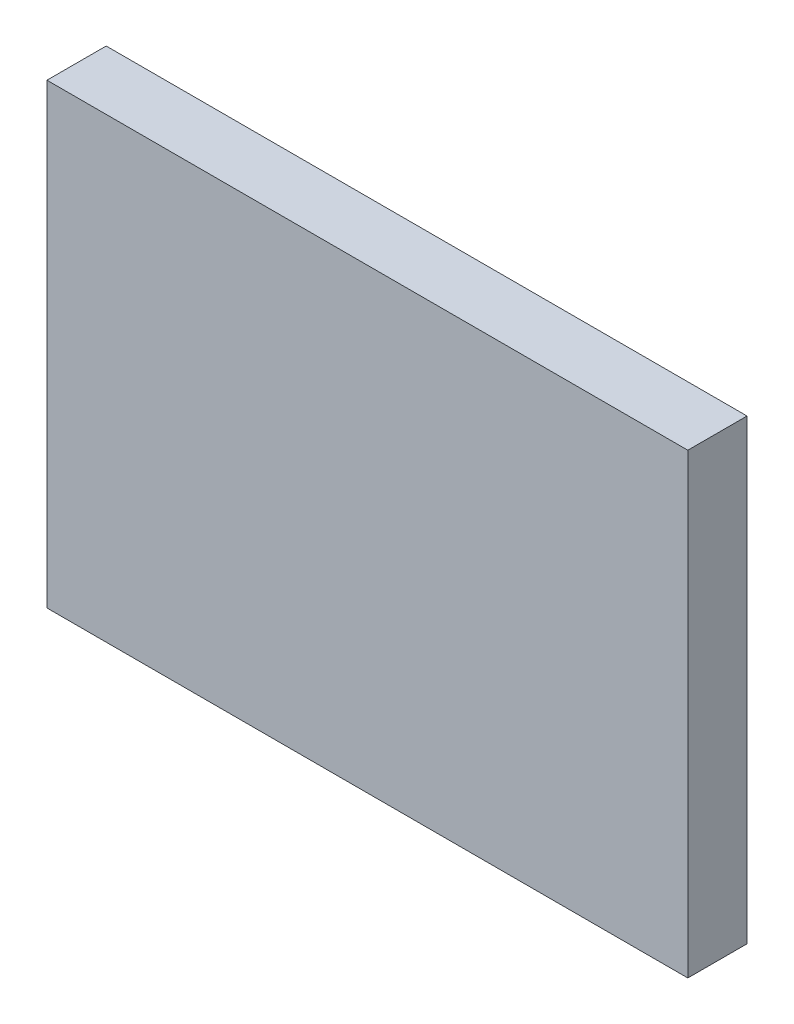
from build123d import *

# Parameters (mm, degrees)
SKETCH1_W           = 68.7
SKETCH1_H           = 55.35
BOSS_EXTRUDE1_DEPTH = 6.35
SKETCH2_W           = 68.7
SKETCH2_H           = 6.35
CUT_EXTRUDE1_DEPTH  = 6.35


with BuildPart() as part:
    # Sketch1 → Boss-Extrude1 (new body)
    with BuildSketch(Plane.XY):
        with Locations((-34.35, 27.675)):
            Rectangle(SKETCH1_W, SKETCH1_H)
    extrude(amount=BOSS_EXTRUDE1_DEPTH)

    # Sketch2 → Cut-Extrude1 (cut)
    with BuildSketch(Plane.XZ):
        with Locations((-34.35, 3.175)):
            Rectangle(SKETCH2_W, SKETCH2_H)
    extrude(amount=-CUT_EXTRUDE1_DEPTH, mode=Mode.SUBTRACT)


solid = part.part
